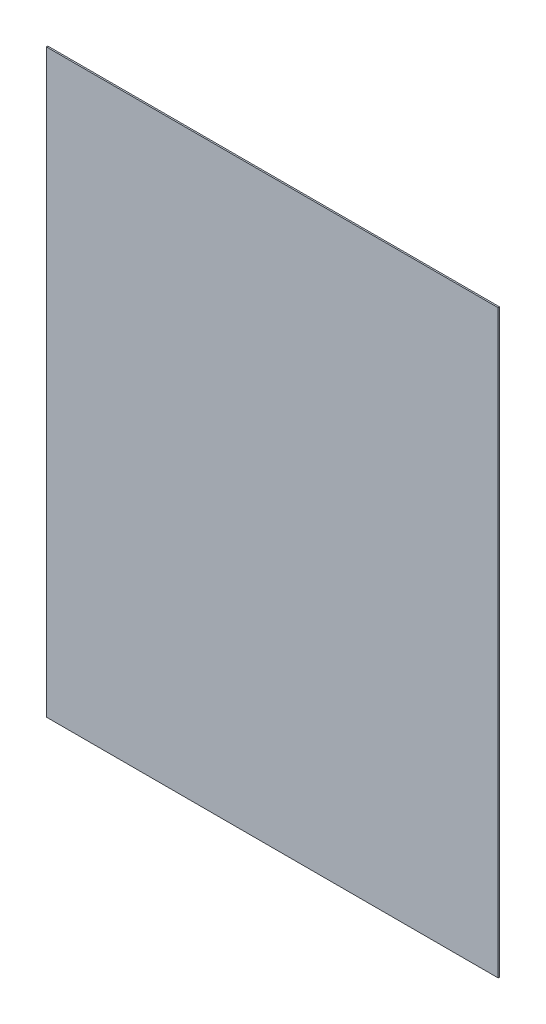
from build123d import *

# Parameters (mm, degrees)
SKETCH1_W           = 246
SKETCH1_H           = 316
BOSS_EXTRUDE1_DEPTH = 0.79375


with BuildPart() as part:
    # Sketch1 → Boss-Extrude1 (new body)
    with BuildSketch(Plane.XY.offset(-53.431159152)):
        with Locations((-22, -18)):
            Rectangle(SKETCH1_W, SKETCH1_H)
    extrude(amount=-BOSS_EXTRUDE1_DEPTH)


solid = part.part
